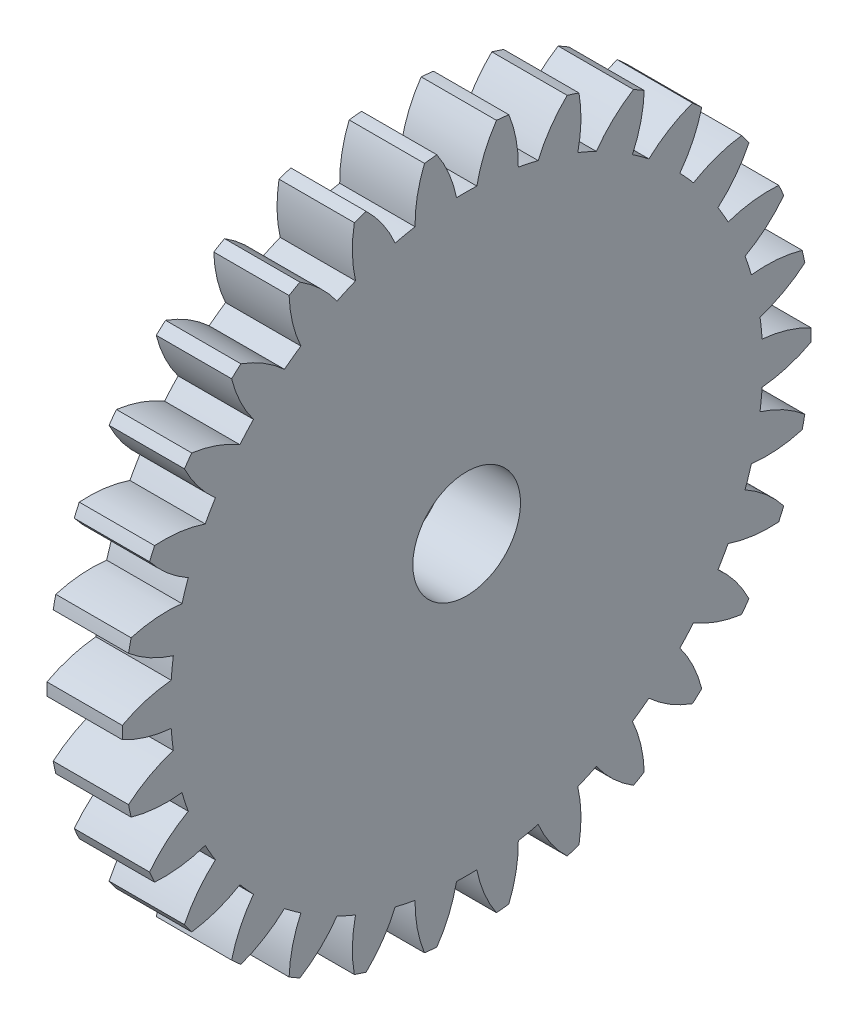
from build123d import *

# Parameters (mm, degrees)
BASPROSKE_W     = 4.445
BASPROSKE_H     = 20.32
TOOTHCUT_DEPTH  = 30.07856298
TEETHCUTS_COUNT = 30
TEETHCUTS_ANGLE = 348
BORSKE_R        = 3.175
BORE_DEPTH      = 50.8000508


with BuildPart() as part:
    # BasProSke → Base-Revolve (revolve)
    with BuildSketch(Plane(origin=(0, 0, 0), x_dir=(1, 0, 0), z_dir=(0, 1, 0)), mode=Mode.PRIVATE) as base_revolve_sk:
        with Locations((2.2225, 10.16)):
            Rectangle(BASPROSKE_W, BASPROSKE_H)
    revolve(base_revolve_sk.sketch.rotate(Axis((-10, 0, 0), (1, 0, 0)), 180), axis=Axis((-10, 0, 0), (1, 0, 0)))

    # TooCutSke → ToothCut (cut, through all)
    with BuildSketch(Plane(origin=(0, 0, 0), x_dir=(0, 0, -1), z_dir=(1, 0, 0))):
        with BuildLine():
            ThreePointArc((0.599155191, 17.464925654), (0, 17.4752), (-0.599155191, 17.464925654))
            ThreePointArc((-0.599155191, 17.464925654), (-1.045947129, 18.925599934), (-1.775089733, 20.267815807))
            ThreePointArc((-1.775089733, 20.267815807), (0, 20.3454), (1.775089733, 20.267815807))
            ThreePointArc((1.775089733, 20.267815807), (1.045947129, 18.925599934), (0.599155191, 17.464925654))
        make_face()
    toothcut = extrude(amount=TOOTHCUT_DEPTH, mode=Mode.SUBTRACT)

    # TeethCuts: ToothCut ×30 about axis
    teethcuts_axis = Axis((-10, 0, 0), (1, 0, 0))
    for i in range(1, TEETHCUTS_COUNT):
        add(toothcut.rotate(teethcuts_axis, i * TEETHCUTS_ANGLE / (TEETHCUTS_COUNT - 1)), mode=Mode.SUBTRACT)

    # BorSke → Bore (cut, symmetric)
    with BuildSketch(Plane(origin=(0, 0, 0), x_dir=(0, 0, -1), z_dir=(1, 0, 0))):
        with Locations(Location((0, 0, 0), (0, 0, 180))):
            Circle(BORSKE_R)
    extrude(amount=BORE_DEPTH, both=True, mode=Mode.SUBTRACT)


solid = part.part
